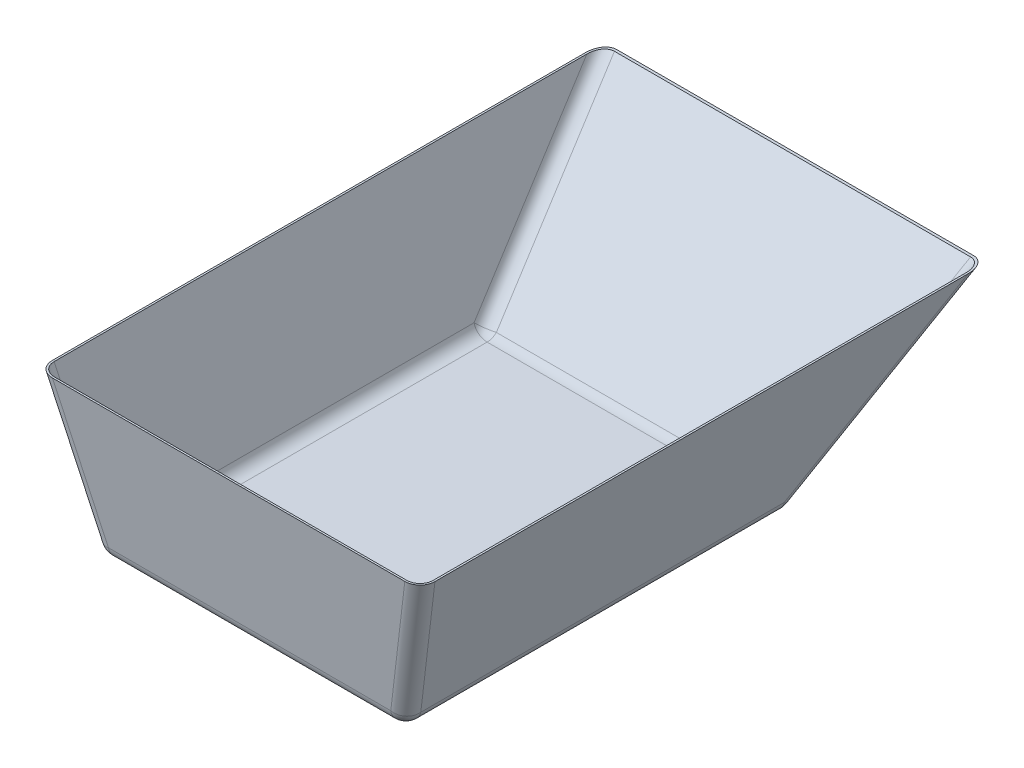
from build123d import *

# Parameters (mm, degrees)
SKETCH_1_W          = 250
SKETCH_1_H          = 100
EXTRUDE_1_DEPTH     = 370
CUT_EXTRUDE_1_DEPTH = 370
CUT_EXTRUDE_3_DEPTH = 458.602447546
FILLET_1_R          = 10
SHELL_2_T           = -1.2


with BuildPart() as part:
    # 草圖1 → 填料-伸長1 (new body)
    with BuildSketch(Plane.XY):
        Rectangle(SKETCH_1_W, SKETCH_1_H)
    extrude(amount=EXTRUDE_1_DEPTH)

    # 草圖2 → 除料-伸長1 (cut)
    with BuildSketch(Plane.XY.offset(370)):
        Polygon((-125, 50), (-100, -50), (-125, -50), align=None)
        Polygon((125, 50), (125, -50), (100, -50), align=None)
    extrude(amount=-CUT_EXTRUDE_1_DEPTH, mode=Mode.SUBTRACT)

    # 草圖7 → 除料-伸長3 (cut, through all)
    with BuildSketch(Plane(origin=(-125, 50, 370), x_dir=(0, 0, 1), z_dir=(-1, 0, 0))):
        Polygon((0, 0), (-15, -100), (0, -100), align=None)
        Polygon((-370, 0), (-265, -100), (-370, -100), align=None)
    extrude(amount=-CUT_EXTRUDE_3_DEPTH, mode=Mode.SUBTRACT)

    # 圓角1
    fillet_1_edges = [part.edges().sort_by_distance(p)[0] for p in [
        (112.5, 0, 362.5),
        (0, -50, 355),
        (-112.5, 0, 362.5),
        (100, -50, 230),
        (112.5, 0, 52.5),
        (-100, -50, 230),
        (-112.5, 0, 52.5),
        (0, -50, 105),
    ]]
    fillet(fillet_1_edges, radius=FILLET_1_R)

    # 薄殼2
    shell_2_openings = [part.faces().sort_by_distance(p)[0] for p in [
        (0, 50, 185.000169968),
    ]]
    offset(amount=SHELL_2_T, openings=shell_2_openings, kind=Kind.INTERSECTION)


solid = part.part
